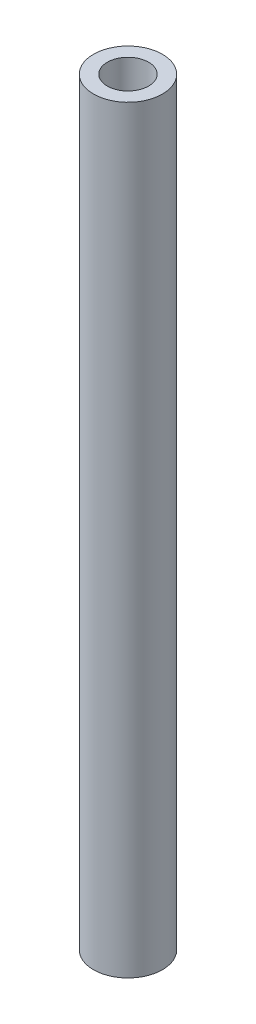
from build123d import *

# Parameters (mm, degrees)
SKETCH_1_R      = 2.5
SKETCH_1_R_2    = 1.5
EXTRUDE_1_DEPTH = 55


with BuildPart() as part:
    # 草图1 → 凸台-拉伸1 (new body)
    with BuildSketch(Plane(origin=(0, 0, 0), x_dir=(1, 0, 0), z_dir=(0, 1, 0))):
        with Locations(Location((0, 0, 0), (0, 0, 270))):
            Circle(SKETCH_1_R)
        with Locations(Location((0, 0, 0), (0, 0, 270))):
            Circle(SKETCH_1_R_2, mode=Mode.SUBTRACT)
    extrude(amount=EXTRUDE_1_DEPTH)


solid = part.part
